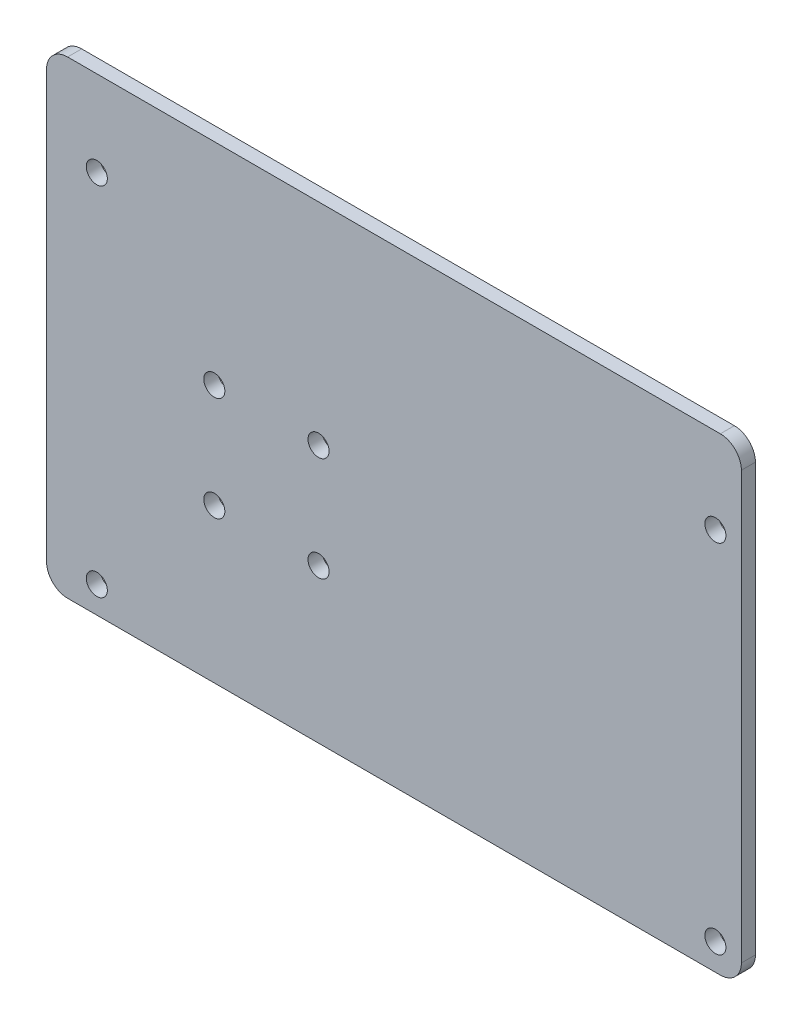
from build123d import *

# Parameters (mm, degrees)
EXTRUDE_1_DEPTH     = 2
SKETCH_2_R          = 1.5
CUT_EXTRUDE_1_DEPTH = 2


with BuildPart() as part:
    # 草图1 → 凸台-拉伸1 (new body)
    with BuildSketch(Plane.XY):
        with BuildLine():
            Line((-49.07040619, 26.293617021), (43.92959381, 26.293617021))
            ThreePointArc((43.92959381, 26.293617021), (46.050914154, 25.414937365), (46.92959381, 23.293617021))
            Line((46.92959381, 23.293617021), (46.92959381, -37.506382979))
            ThreePointArc((46.92959381, -37.506382979), (46.050914154, -39.627703322), (43.92959381, -40.506382979))
            Line((43.92959381, -40.506382979), (-49.07040619, -40.506382979))
            ThreePointArc((-49.07040619, -40.506382979), (-51.191726533, -39.627703322), (-52.07040619, -37.506382979))
            Line((-52.07040619, -37.506382979), (-52.07040619, 23.293617021))
            ThreePointArc((-52.07040619, 23.293617021), (-51.191726533, 25.414937365), (-49.07040619, 26.293617021))
        make_face()
    extrude(amount=EXTRUDE_1_DEPTH)

    # 草图2 → 切除-拉伸1 (cut)
    with BuildSketch(Plane.XY.offset(2)):
        with Locations((-44.91440619, 14.101617021)):
            Circle(SKETCH_2_R)
        with Locations((43.22559381, 14.101617021)):
            Circle(SKETCH_2_R)
        with Locations((-44.91440619, -36.698382979)):
            Circle(SKETCH_2_R)
        with Locations((43.22559381, -36.698382979)):
            Circle(SKETCH_2_R)
        with Locations((-28.17040619, -3.745140574)):
            Circle(SKETCH_2_R)
        with Locations((-28.17040619, -18.594382979)):
            Circle(SKETCH_2_R)
        with Locations((-13.321163785, -3.745140574)):
            Circle(SKETCH_2_R)
        with Locations((-13.321163785, -18.594382979)):
            Circle(SKETCH_2_R)
    extrude(amount=-CUT_EXTRUDE_1_DEPTH, mode=Mode.SUBTRACT)


solid = part.part
